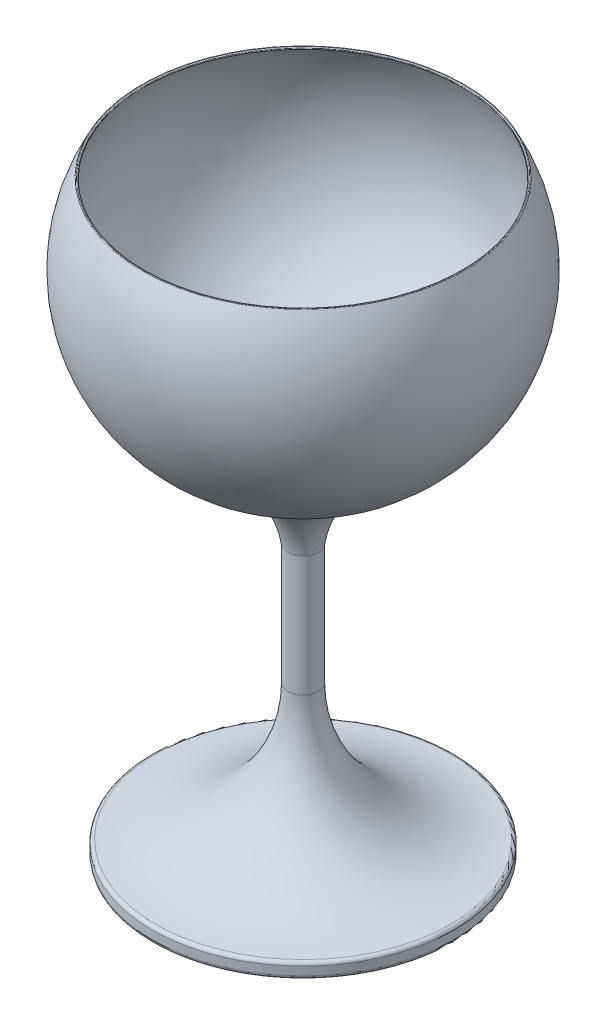
from build123d import *


with BuildPart() as part:
    # Sketch1 → Revolve1 (revolve)
    with BuildSketch(Plane.XY, mode=Mode.PRIVATE) as revolve1_sk:
        with BuildLine():
            Line((4.5, -112.912710018), (4.5, -77.400513082))
            ThreePointArc((4.5, -77.400513082), (10.157527956, -63.412584413), (21.908713564, -53.947944544))
            Line((21.908713564, -53.947944544), (24.061741844, -52.976555701))
            ThreePointArc((24.061741844, -52.976555701), (50.832757998, -23.510137145), (47.595014323, 16.169506808))
            ThreePointArc((47.595014323, 16.169506808), (47.476302171, 16.26673123), (47.323642773, 16.251230533))
            Line((47.323642773, 16.251230533), (47.015633614, 16.085000729))
            ThreePointArc((47.015633614, 16.085000729), (46.919117621, 15.966671356), (46.934234761, 15.814721859))
            ThreePointArc((46.934234761, 15.814721859), (50.122526831, -23.26915543), (23.753301451, -52.292915061))
            Line((23.753301451, -52.292915061), (19.546632273, -54.190851816))
            ThreePointArc((19.546632273, -54.190851816), (19.025277538, -54.391822689), (18.484754788, -54.533368465))
            ThreePointArc((18.484754788, -54.533368465), (9.267019766, -56.254407976), (0, -57.686525492))
            Line((0, -57.686525492), (0, -153.400513082))
            ThreePointArc((0, -153.400513082), (16.092933986, -154.702823311), (32.028382595, -157.298976976))
            ThreePointArc((32.028382595, -157.298976976), (32.527079523, -157.375064291), (33.030905153, -157.400513082))
            Line((33.030905153, -157.400513082), (43.5, -157.400513082))
            ThreePointArc((43.5, -157.400513082), (44.207106781, -157.107619863), (44.5, -156.400513082))
            Line((44.5, -156.400513082), (44.5, -153.900513082))
            ThreePointArc((44.5, -153.900513082), (44.215678085, -153.202082786), (43.524390244, -152.900810568))
            ThreePointArc((43.524390244, -152.900810568), (15.872876583, -140.849921848), (4.5, -112.912710018))
        make_face()
    revolve(revolve1_sk.sketch.rotate(Axis((0, -162.570284158, 0), (0, 1, 0)), 90), axis=Axis((0, -162.570284158, 0), (0, 1, 0)))


solid = part.part
